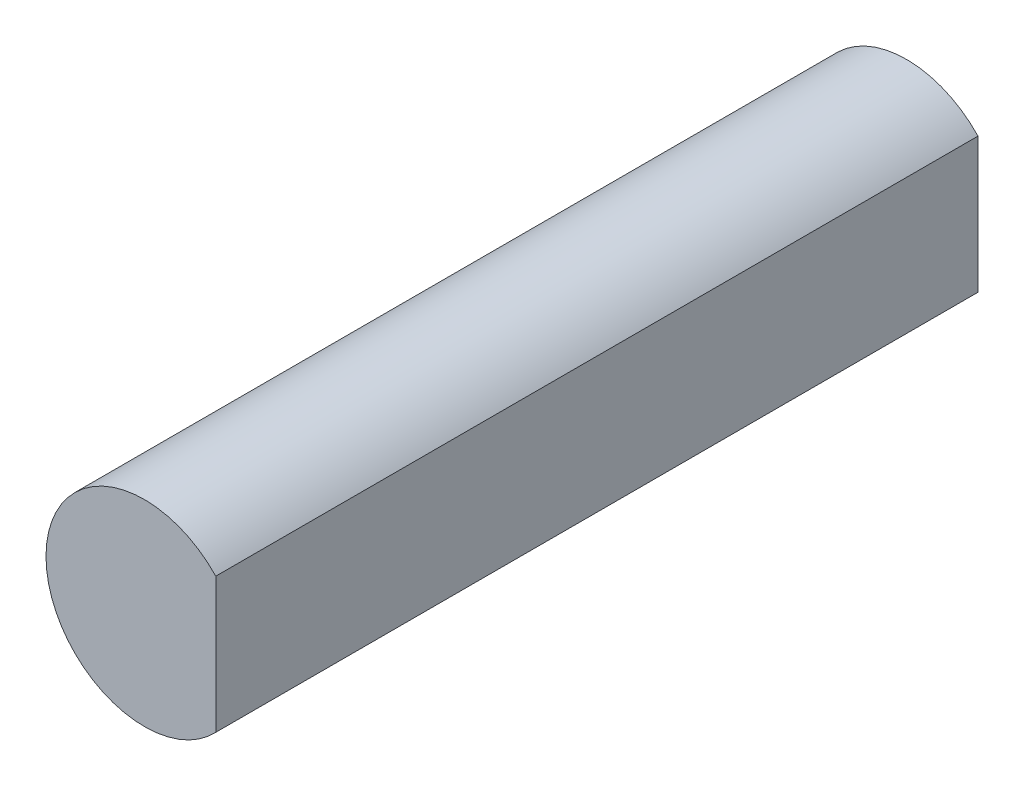
from build123d import *

# Parameters (mm, degrees)
SALIENTE_EXTRUIR1_DEPTH = 31
SALIENTE_EXTRUIR2_START = -6.2
SALIENTE_EXTRUIR2_DEPTH = 6.2
CROQUIS5_R              = 2.5
CORTAR_EXTRUIR1_DEPTH   = 5


with BuildPart() as part:
    # Croquis1 → Saliente-Extruir1 (new body)
    with BuildSketch(Plane.XY):
        with BuildLine():
            Line((2.90473751, 2.75), (2.90473751, -2.75))
            ThreePointArc((2.90473751, -2.75), (-4, 0), (2.90473751, 2.75))
        make_face()
        with BuildLine():
            Line((2, 1.5), (2, -1.5))
            ThreePointArc((2, -1.5), (-2.5, 0), (2, 1.5))
        make_face(mode=Mode.SUBTRACT)
    extrude(amount=SALIENTE_EXTRUIR1_DEPTH)

    # Croquis2 → Saliente-Extruir2 (add)
    with BuildSketch(Plane.XY.offset(31).offset(SALIENTE_EXTRUIR2_START)):
        with BuildLine():
            Line((2.90473751, 2.75), (2.90473751, -2.75))
            ThreePointArc((2.90473751, -2.75), (-4, 0), (2.90473751, 2.75))
        make_face()
    extrude(amount=SALIENTE_EXTRUIR2_DEPTH)

    # Croquis5 → Cortar-Extruir1 (cut)
    with BuildSketch(Plane(origin=(0, 0, 0), x_dir=(-1, 0, 0), z_dir=(0, 0, -1))):
        with Locations(Location((0, 0, 0), (0, 0, 216.869897646))):
            Circle(CROQUIS5_R)
    extrude(amount=-CORTAR_EXTRUIR1_DEPTH, mode=Mode.SUBTRACT)


solid = part.part
